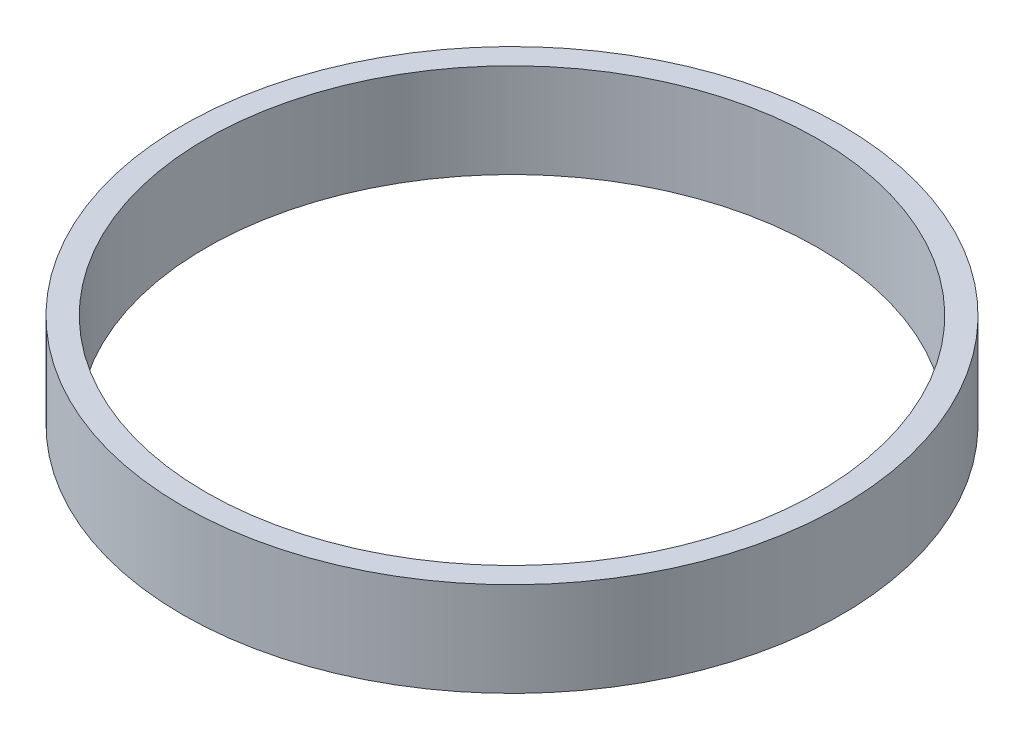
from build123d import *

# Parameters (mm, degrees)
EXTRUDE_1_DEPTH = 10


with BuildPart() as part:
    # 草图1 → 凸台-拉伸1 (new body)
    with BuildSketch(Plane(origin=(0, 0, 0), x_dir=(1, 0, 0), z_dir=(0, 1, 0))):
        with BuildLine():
            ThreePointArc((35, 0), (0, 35), (-35, 0))
            Line((-35, 0), (-32.5, 0))
            ThreePointArc((-32.5, 0), (0, 32.5), (32.5, 0))
            Line((32.5, 0), (35, 0))
        make_face()
        with BuildLine():
            Line((-32.5, 0), (-35, 0))
            ThreePointArc((-35, 0), (0, -35), (35, 0))
            Line((35, 0), (32.5, 0))
            ThreePointArc((32.5, 0), (0, -32.5), (-32.5, 0))
        make_face()
    extrude(amount=EXTRUDE_1_DEPTH)


solid = part.part
